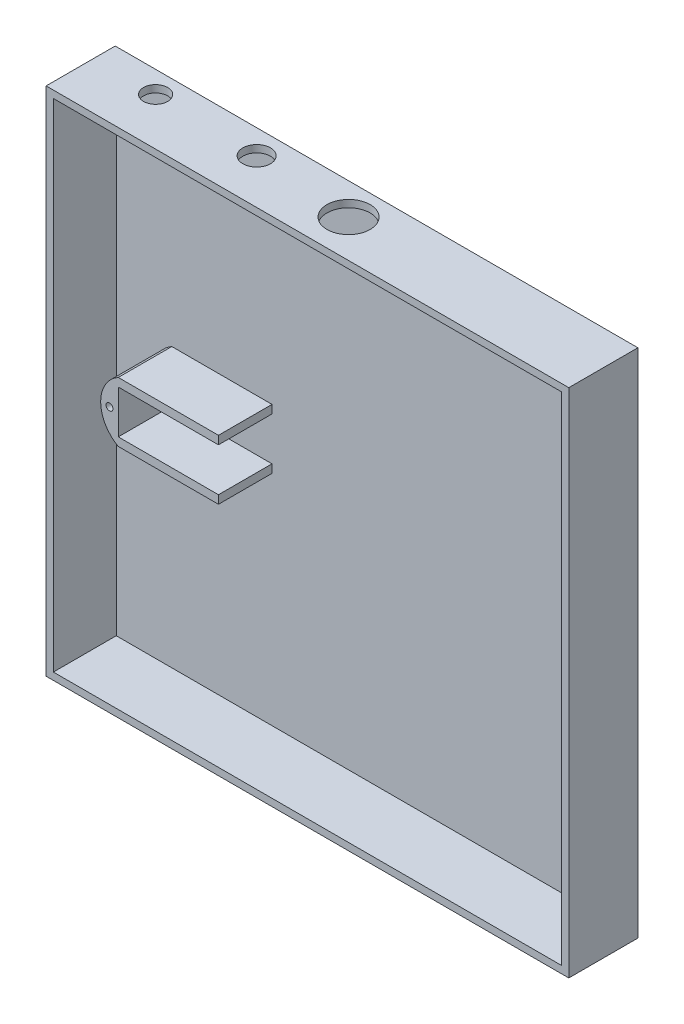
from build123d import *

# Parameters (mm, degrees)
CROQUIS1_W              = 151.3
CROQUIS1_H              = 148
SALIENTE_EXTRUIR1_DEPTH = 1.8
CROQUIS2_W              = 151.3
CROQUIS2_H              = 148
CROQUIS2_W_2            = 147.1
CROQUIS2_H_2            = 143.8
SALIENTE_EXTRUIR2_DEPTH = 18.2
CROQUIS4_R              = 6.25
CROQUIS4_R_2            = 3.5
CROQUIS4_R_3            = 4
CORTAR_EXTRUIR1_DEPTH   = 2.1
CROQUIS5_R              = 1
SALIENTE_EXTRUIR3_DEPTH = 15.5


with BuildPart() as part:
    # Croquis1 → Saliente-Extruir1 (new body)
    with BuildSketch(Plane.XY):
        with Locations((-105.482201909, -12.901601831)):
            Rectangle(CROQUIS1_W, CROQUIS1_H)
    extrude(amount=SALIENTE_EXTRUIR1_DEPTH)

    # Croquis2 → Saliente-Extruir2 (add)
    with BuildSketch(Plane.XY.offset(1.8)):
        with Locations((-105.482201909, -12.901601831)):
            Rectangle(CROQUIS2_W, CROQUIS2_H)
        with Locations((-105.482201909, -12.901601831)):
            Rectangle(CROQUIS2_W_2, CROQUIS2_H_2, mode=Mode.SUBTRACT)
    extrude(amount=SALIENTE_EXTRUIR2_DEPTH)

    # Croquis4 → Cortar-Extruir1 (cut)
    with BuildSketch(Plane(origin=(0, 61.098398169, 0), x_dir=(1, 0, 0), z_dir=(0, 1, 0))):
        with Locations(Location((-104.482201909, -9.1, 0), (0, 0, 270))):
            Circle(CROQUIS4_R)
        with Locations(Location((-163.132201909, -6.3, 0), (0, 0, 270))):
            Circle(CROQUIS4_R_2)
        with Locations(Location((-133.132201909, -7.05, 0), (0, 0, 270))):
            Circle(CROQUIS4_R_3)
    extrude(amount=-CORTAR_EXTRUIR1_DEPTH, mode=Mode.SUBTRACT)

    # Croquis5 → Saliente-Extruir3 (add)
    with BuildSketch(Plane.XY.offset(1.8)):
        with BuildLine():
            Line((-133.94514144, -4.251601831), (-133.94514144, -6.651601831))
            Line((-133.94514144, -6.651601831), (-162.94514144, -6.651601831))
            Line((-162.94514144, -6.651601831), (-162.94514144, -19.151601831))
            Line((-162.94514144, -19.151601831), (-133.94514144, -19.151601831))
            Line((-133.94514144, -19.151601831), (-133.94514144, -21.551601831))
            Line((-133.94514144, -21.551601831), (-162.94514144, -21.551601831))
            ThreePointArc((-162.94514144, -21.551601831), (-168.04514144, -12.901601831), (-162.94514144, -4.251601831))
            Line((-162.94514144, -4.251601831), (-133.94514144, -4.251601831))
        make_face()
        with Locations((-165.49514144, -12.901601831)):
            Circle(CROQUIS5_R, mode=Mode.SUBTRACT)
    extrude(amount=SALIENTE_EXTRUIR3_DEPTH)


solid = part.part
